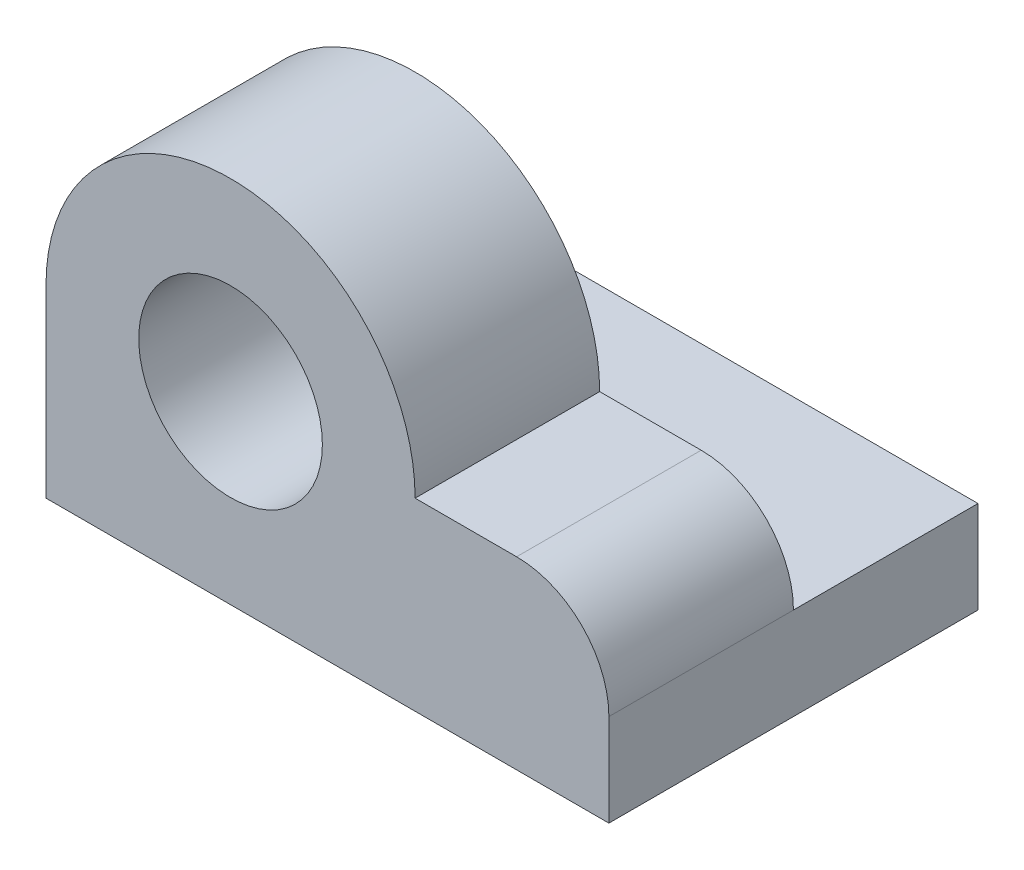
from build123d import *

# Parameters (mm, degrees)
SKETCH1_W           = 1016
SKETCH1_H           = 254
BOSS_EXTRUDE1_DEPTH = 1549.4
SKETCH2_R           = 252.73
BOSS_EXTRUDE2_DEPTH = 508


with BuildPart() as part:
    # Sketch1 → Boss-Extrude1 (new body)
    with BuildSketch(Plane(origin=(0, 0, 0), x_dir=(0, 0, -1), z_dir=(1, 0, 0))):
        with Locations((508, 127)):
            Rectangle(SKETCH1_W, SKETCH1_H)
    extrude(amount=BOSS_EXTRUDE1_DEPTH)

    # Sketch2 → Boss-Extrude2 (add)
    with BuildSketch(Plane.XY):
        with BuildLine():
            Line((0, 508), (0, 254))
            Line((0, 254), (1549.4, 254))
            ThreePointArc((1549.4, 254), (1475.005122421, 433.605122421), (1295.4, 508))
            Line((1295.4, 508), (1016, 508))
            ThreePointArc((1016, 508), (508, 1016), (0, 508))
        make_face()
        with Locations((508, 508)):
            Circle(SKETCH2_R, mode=Mode.SUBTRACT)
    extrude(amount=-BOSS_EXTRUDE2_DEPTH)


solid = part.part
